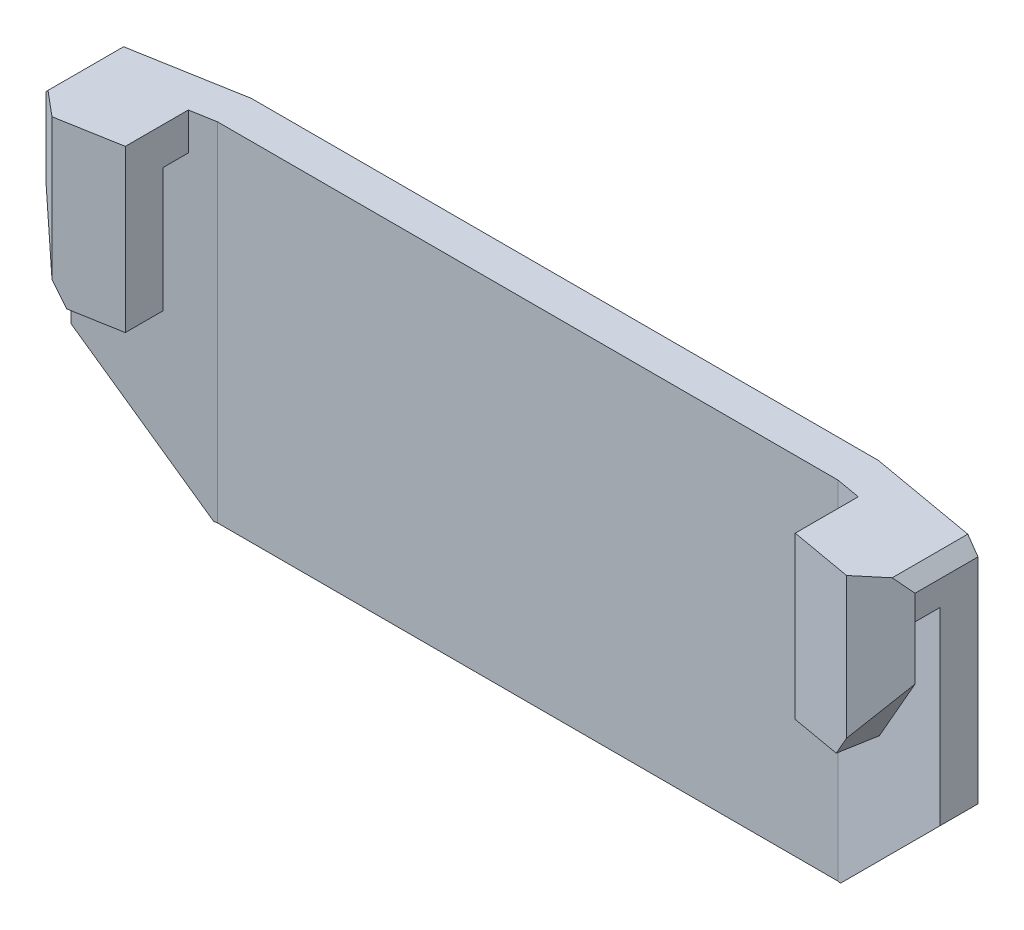
from build123d import *

# Parameters (mm, degrees)
BOSS_EXTRUDE1_DEPTH = 3
BOSS_EXTRUDE2_DEPTH = 25
BOSS_EXTRUDE3_START = -3
BOSS_EXTRUDE3_DEPTH = 13
BOSS_EXTRUDE5_DEPTH = 28
CUT_EXTRUDE9_START  = -4.767335
CUT_EXTRUDE9_DEPTH  = 4.767335
CUT_EXTRUDE10_DEPTH = 3
CUT_EXTRUDE11_DEPTH = 3
CUT_EXTRUDE14_START = -13
CUT_EXTRUDE14_DEPTH = 11.360991
CUT_EXTRUDE15_START = -13
CUT_EXTRUDE15_DEPTH = 11.360991
CHAMFER4_SIZE       = 1


with BuildPart() as part:
    # Sketch12 → Boss-Extrude1 (new body)
    with BuildSketch(Plane(origin=(0, 0, 0), x_dir=(1, 0, 0), z_dir=(0, 1, 0))):
        Polygon((-27, -6.414360409), (-27, -2.352653961), (-25, -2), (25, -2), (27, -2.352653961), (27, -6.414360409), (35.023054857, -7.829041448), (35.023054857, -1.736481777), (25.174977327, 0), (-25.174977327, 0), (-35.023054857, -1.736481777), (-35.023054857, -7.829041448), align=None)
    extrude(amount=BOSS_EXTRUDE1_DEPTH)

    # Sketch13 → Boss-Extrude2 (add)
    with BuildSketch(Plane.XZ):
        Polygon((25.174977327, 0), (35.023054857, 1.736481777), (35.023054857, 3.767335), (27, 2.352653961), (25, 2), (-25, 2), (-27, 2.352653961), (-35.023054857, 3.767335), (-35.023054857, 1.736481777), (-25.174977327, 0), align=None)
    extrude(amount=BOSS_EXTRUDE2_DEPTH)

    # Sketch14 → Boss-Extrude3 (add)
    with BuildSketch(Plane.XZ.offset(BOSS_EXTRUDE3_START)):
        Polygon((-35.023054857, 5.798188224), (-27, 4.383507185), (-27, 7.429787021), (-35.023054857, 8.84446806), align=None)
        Polygon((27, 7.429787021), (35.023054857, 8.84446806), (35.023054857, 5.798188224), (27, 4.383507185), align=None)
    extrude(amount=BOSS_EXTRUDE3_DEPTH)

    # Sketch24 → Boss-Extrude5 (add)
    with BuildSketch(Plane(origin=(0, 3, 0), x_dir=(1, 0, 0), z_dir=(0, 1, 0))):
        Polygon((-35.023054857, -0.721055165), (-25.262465991, 1), (25.262465991, 1), (35.023054857, -0.721055165), (35.023054857, -1.736481777), (25.174977327, 0), (-25.174977327, 0), (-35.023054857, -1.736481777), align=None)
    extrude(amount=-BOSS_EXTRUDE5_DEPTH)

    # Sketch26 → Cut-Extrude9 (cut)
    with BuildSketch(Plane(origin=(0, 0, -1), x_dir=(-1, 0, 0), z_dir=(0, 0, -1)).offset(CUT_EXTRUDE9_START)):
        Polygon((-25.262465991, -25), (-35.023054857, -25), (-35.023054857, -15.239411133), align=None)
        Polygon((25.262465991, -25), (35.023054857, -15.239411133), (35.023054857, -25), align=None)
    extrude(amount=CUT_EXTRUDE9_DEPTH, mode=Mode.SUBTRACT)

    # Sketch27 → Cut-Extrude10 (cut)
    with BuildSketch(Plane(origin=(0.456418791, 0, 2.588479594), x_dir=(0.9848077530121054, 0, -0.17364817766751295), z_dir=(0.17364817766751295, 0, 0.9848077530121054))):
        Polygon((-36.026801719, -3.5), (-31.953390013, -10), (-36.026801719, -10), align=None)
    extrude(amount=-CUT_EXTRUDE10_DEPTH, mode=Mode.SUBTRACT)

    # Sketch28 → Cut-Extrude11 (cut)
    with BuildSketch(Plane(origin=(-0.456418791, 0, 2.588479594), x_dir=(0.9848077530121067, 0, 0.17364817766750618), z_dir=(-0.17364817766750618, 0, 0.9848077530121067))):
        Polygon((36.026801719, -3.5), (31.953390013, -10), (36.026801719, -10), align=None)
    extrude(amount=-CUT_EXTRUDE11_DEPTH, mode=Mode.SUBTRACT)

    # Sketch31 → Cut-Extrude14 (cut)
    with BuildSketch(Plane.XZ.offset(10).offset(CUT_EXTRUDE14_START)):
        Polygon((35.023054857, 5.798188224), (32.023054857, 8.315487118), (35.023054857, 8.84446806), align=None)
    extrude(amount=CUT_EXTRUDE14_DEPTH, mode=Mode.SUBTRACT)

    # Sketch33 → Cut-Extrude15 (cut)
    with BuildSketch(Plane.XZ.offset(10).offset(CUT_EXTRUDE15_START)):
        Polygon((-35.023054857, 5.798188224), (-32.023054857, 8.315487118), (-35.023054857, 8.84446806), align=None)
    extrude(amount=CUT_EXTRUDE15_DEPTH, mode=Mode.SUBTRACT)

    # Chamfer4
    chamfer4_edges = [part.edges().sort_by_distance(p)[0] for p in [
        (35.023054857, 3, 3.259621695),
        (-35.023054857, 3, 3.259621695),
    ]]
    chamfer(chamfer4_edges, length=CHAMFER4_SIZE)


solid = part.part
